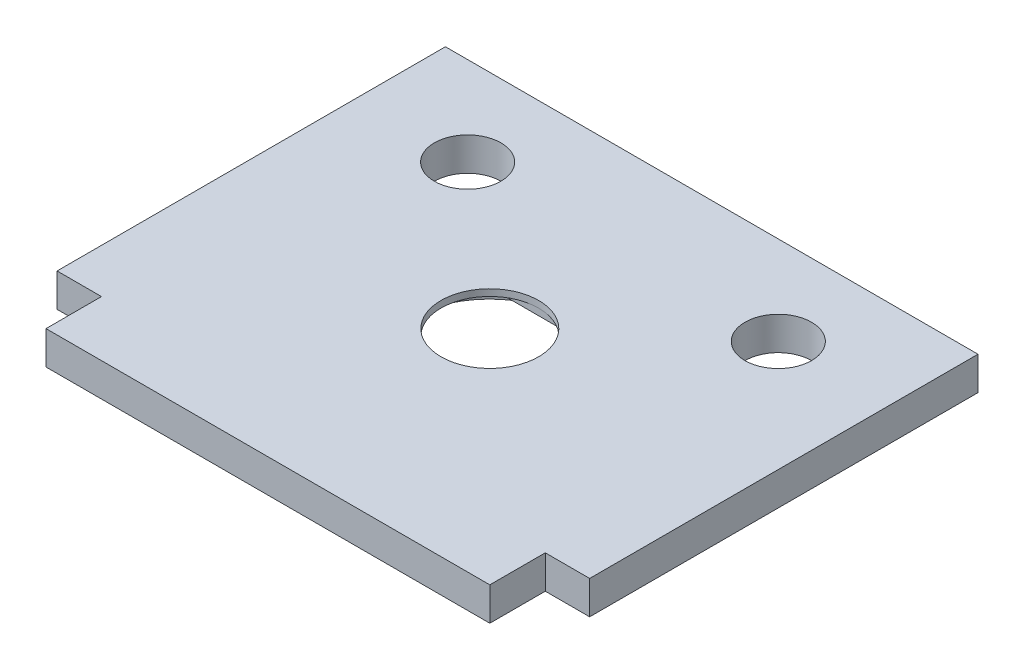
from build123d import *
from build123d.topology import SkipClean

# Parameters (mm, degrees)
BOSS_EXTRUDE1_DEPTH = 1.5
SKETCH3_R           = 3.75
CUT_EXTRUDE1_DEPTH  = 0.9
SKETCH4_R           = 2.2
CUT_EXTRUDE2_DEPTH  = 0.9
SKETCH5_R           = 1.5
CUT_EXTRUDE3_DEPTH  = 6
CUT_EXTRUDE4_DEPTH  = 0.3


with BuildPart() as part:
    # Sketch1 → Boss-Extrude1 (new body)
    with BuildSketch(Plane(origin=(0, 0, 0), x_dir=(1, 0, 0), z_dir=(0, 1, 0))):
        Polygon((-13.430051813, 17.5), (-13.430051813, 0), (-11.430051813, 0), (-11.430051813, -2.5), (8.569948187, -2.5), (8.569948187, 0), (10.569948187, 0), (10.569948187, 17.5), align=None)
    extrude(amount=BOSS_EXTRUDE1_DEPTH)

    # Sketch3 → Cut-Extrude1 (cut)
    with BuildSketch(Plane.XZ):
        with Locations(Location((-1.430051813, -7.5, 0), (0, 0, 270))):
            Circle(SKETCH3_R)
    extrude(amount=-CUT_EXTRUDE1_DEPTH, mode=Mode.SUBTRACT)

    # Sketch4 → Cut-Extrude2 (cut)
    with BuildSketch(Plane.XZ.offset(-0.9)):
        with Locations(Location((-1.430051813, -7.5, 0), (0, 0, 270))):
            Circle(SKETCH4_R)
    extrude(amount=-CUT_EXTRUDE2_DEPTH, mode=Mode.SUBTRACT)

    # Sketch5 → Cut-Extrude3 (cut)
    with BuildSketch(Plane.XZ):
        with Locations(Location((-8.430051813, -13.5, 0), (0, 0, 270))):
            Circle(SKETCH5_R)
        with Locations(Location((5.569948187, -13.5, 0), (0, 0, 270))):
            Circle(SKETCH5_R)
    extrude(amount=-CUT_EXTRUDE3_DEPTH, mode=Mode.SUBTRACT)

    # Sketch6 → Cut-Extrude4 (cut)
    with SkipClean():  # the faces are left unmerged after this step: merging them gives an invalid solid
        with BuildSketch(Plane.XZ.offset(-0.9)):
            with BuildLine():
                Line((1.606805114, -9.7), (-4.466908741, -9.7))
                ThreePointArc((-4.466908741, -9.7), (-5.180051813, -7.5), (-4.466908741, -5.3))
                Line((-4.466908741, -5.3), (1.606805114, -5.3))
                ThreePointArc((1.606805114, -5.3), (2.319948187, -7.5), (1.606805114, -9.7))
            make_face()
        extrude(amount=-CUT_EXTRUDE4_DEPTH, mode=Mode.SUBTRACT)


solid = part.part
